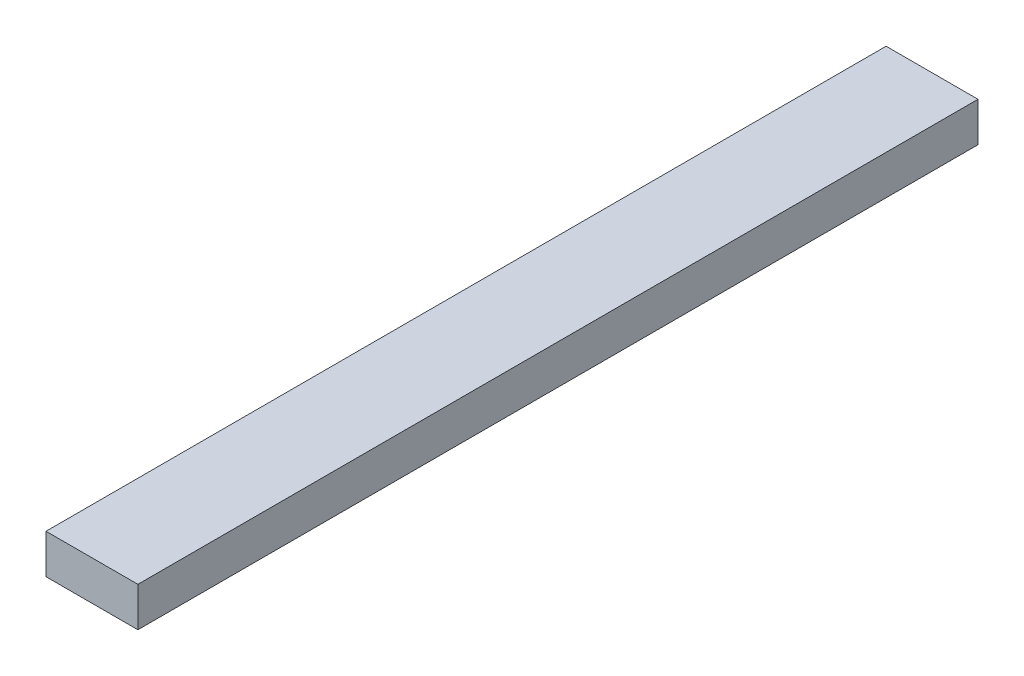
from build123d import *

# Parameters (mm, degrees)
SKETCH1_W           = 88.9
SKETCH1_H           = 38.1
BOSS_EXTRUDE1_DEPTH = 812.8


with BuildPart() as part:
    # Sketch1 → Boss-Extrude1 (new body)
    with BuildSketch(Plane.XY):
        Rectangle(SKETCH1_W, SKETCH1_H)
    extrude(amount=BOSS_EXTRUDE1_DEPTH)


solid = part.part
